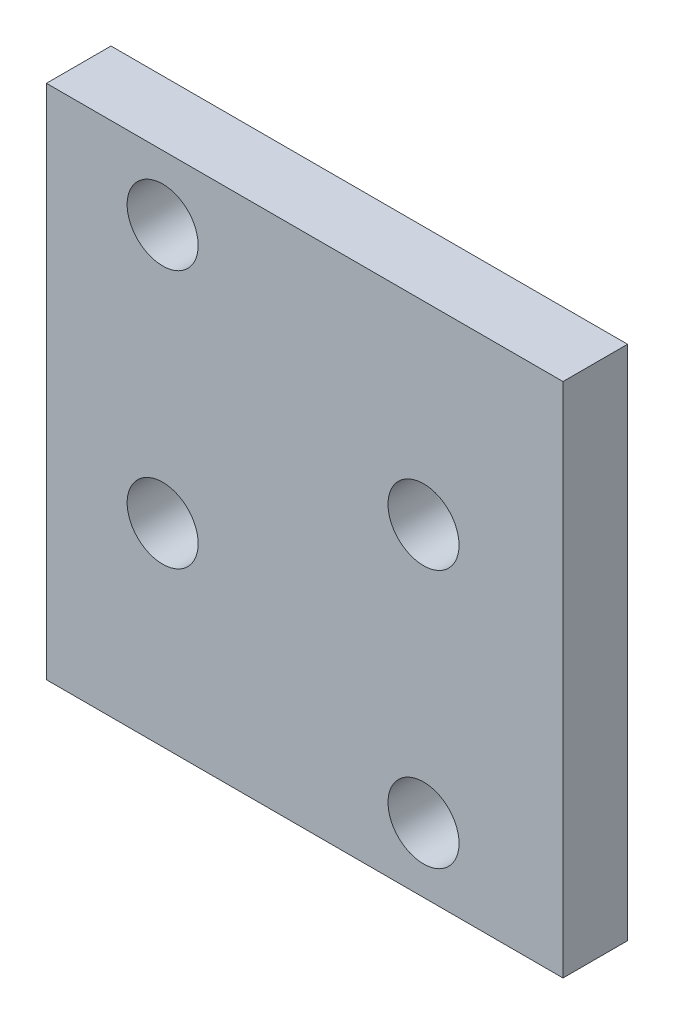
from build123d import *

# Parameters (mm, degrees)
SKETCH_1_W          = 40
SKETCH_1_H          = 40
EXTRUDE_1_DEPTH     = 5
SKETCH_2_R          = 2.75
CUT_EXTRUDE_1_DEPTH = 57.789083458


with BuildPart() as part:
    # Эскиз1 → Бобышка-Вытянуть1 (new body)
    with BuildSketch(Plane.XY):
        with Locations((20, 20)):
            Rectangle(SKETCH_1_W, SKETCH_1_H)
    extrude(amount=EXTRUDE_1_DEPTH)

    # Эскиз2 → Вырез-Вытянуть1 (cut, through all)
    with BuildSketch(Plane.XY.offset(5)):
        with Locations((9, 35)):
            Circle(SKETCH_2_R)
        with Locations((9, 15)):
            Circle(SKETCH_2_R)
        with Locations((29.2, 5)):
            Circle(SKETCH_2_R)
        with Locations((29.2, 25)):
            Circle(SKETCH_2_R)
    extrude(amount=-CUT_EXTRUDE_1_DEPTH, mode=Mode.SUBTRACT)


solid = part.part
